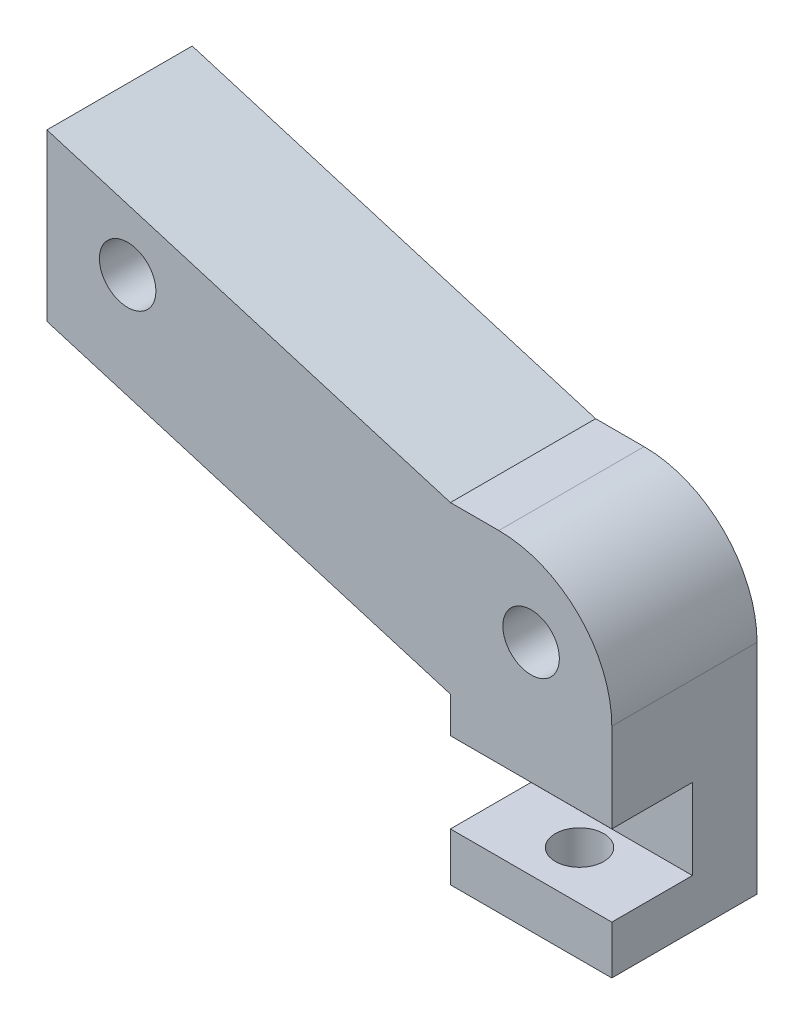
from build123d import *

# Parameters (mm, degrees)
BOSS_EXTRUDE1_DEPTH = 9
SKETCH3_R           = 1.75
CUT_EXTRUDE1_DEPTH  = 9
SKETCH5_R           = 1.5
CUT_EXTRUDE2_DEPTH  = 10
SKETCH6_W           = 4.996186888
SKETCH6_H           = 5
CUT_EXTRUDE3_DEPTH  = 10
FILLET1_R           = 7


with BuildPart() as part:
    # Sketch2 → Boss-Extrude1 (new body)
    with BuildSketch(Plane.XY):
        Polygon((-15.81579683, -97.193157961), (-15.81579683, -107.474376779), (9.18420317, -114.974376779), (9.18420317, -125.206503808), (19.18420317, -125.206503808), (19.18420317, -114.974376779), (19.18420317, -104.693157961), (9.18420317, -104.693157961), align=None)
    extrude(amount=BOSS_EXTRUDE1_DEPTH)

    # Sketch3 → Cut-Extrude1 (cut)
    with BuildSketch(Plane.XY.offset(9)):
        with Locations((14.18420317, -109.693157961)):
            Circle(SKETCH3_R)
        with Locations((-10.81579683, -102.474376779)):
            Circle(SKETCH3_R)
    extrude(amount=-CUT_EXTRUDE1_DEPTH, mode=Mode.SUBTRACT)

    # Sketch5 → Cut-Extrude2 (cut)
    with BuildSketch(Plane.XZ.offset(125.206503808)):
        with Locations(Location((14.18420317, 6, 0), (0, 0, 270))):
            Circle(SKETCH5_R)
    extrude(amount=-CUT_EXTRUDE2_DEPTH, mode=Mode.SUBTRACT)

    # Sketch6 → Cut-Extrude3 (cut)
    with BuildSketch(Plane(origin=(19.18420317, 0, 0), x_dir=(0, 0, -1), z_dir=(1, 0, 0))):
        with Locations((-6.501906556, -119.706503808)):
            Rectangle(SKETCH6_W, SKETCH6_H)
    extrude(amount=-CUT_EXTRUDE3_DEPTH, mode=Mode.SUBTRACT)

    # Fillet1
    fillet1_edges = [part.edges().sort_by_distance(p)[0] for p in [
        (19.18420317, -104.693157961, 4.5),
    ]]
    fillet(fillet1_edges, radius=FILLET1_R)


solid = part.part
